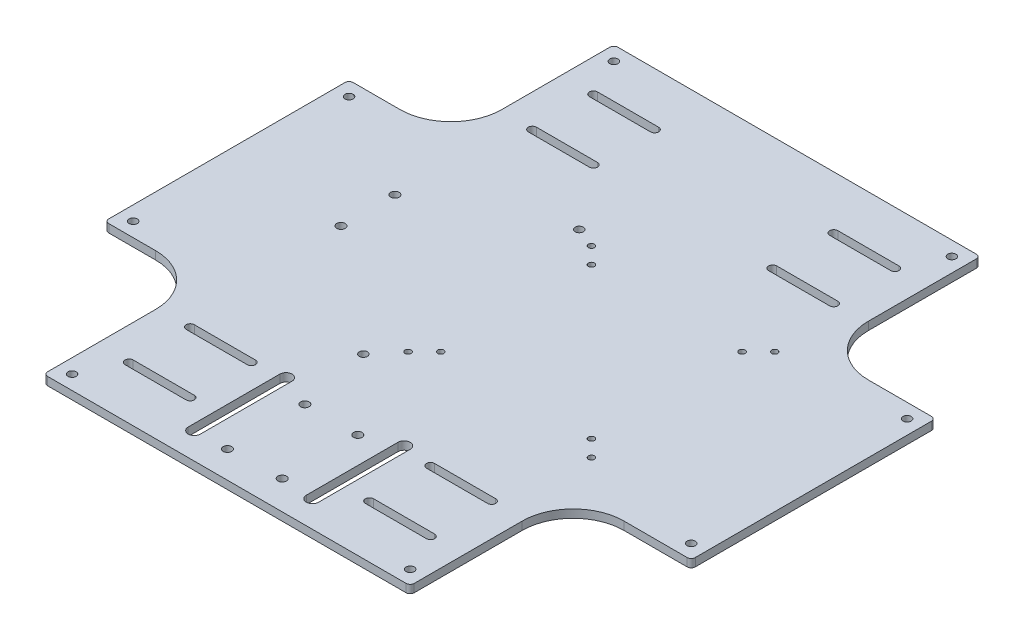
from build123d import *

# Parameters (mm, degrees)
SKETCH_1_R               = 2
EXTRUDE_1_DEPTH          = 4
CUT_EXTRUDE_1_DEPTH      = 202.596130915
CUT_EXTRUDE_1_DEPTH_BACK = 202.596130915
CUT_EXTRUDE_2_DEPTH      = 202.596130915
CUT_EXTRUDE_2_DEPTH_BACK = 202.596130915
SKETCH_3_R               = 2.1
SKETCH_4_W               = 8
SKETCH_4_H               = 120
EXTRUDE_2_DEPTH          = 4
CUT_EXTRUDE_4_DEPTH      = 208.231754324
CUT_EXTRUDE_4_DEPTH_BACK = 208.231754324
SKETCH_6_R               = 2
CUT_EXTRUDE_5_DEPTH      = 208.231754324
CUT_EXTRUDE_6_DEPTH      = 221.692093198
CUT_EXTRUDE_6_DEPTH_BACK = 221.692093198
SKETCH_9_R               = 1.5
FILLET_1_R               = 2
FILLET_2_R               = 25
SKETCH_11_R              = 2.1
CUT_EXTRUDE_7_DEPTH      = 10


with BuildPart() as part:
    # 草图1 → 凸台-拉伸1 (new body)
    with BuildSketch(Plane(origin=(0, 0, 0), x_dir=(1, 0, 0), z_dir=(0, 1, 0))):
        Polygon((-90, -145), (90, -145), (90, -65), (140, -65), (140, 55), (90, 55), (90, 135), (-90, 135), (-90, 55), (-140, 55), (-140, -65), (-90, -65), align=None)
        with Locations(Location((-83, -138, 0), (0, 0, 270))):
            Circle(SKETCH_1_R, mode=Mode.SUBTRACT)
        with Locations(Location((-83, 128, 0), (0, 0, 270))):
            Circle(SKETCH_1_R, mode=Mode.SUBTRACT)
        with Locations(Location((83, -138, 0), (0, 0, 90))):
            Circle(SKETCH_1_R, mode=Mode.SUBTRACT)
        with Locations(Location((83, 128, 0), (0, 0, 90))):
            Circle(SKETCH_1_R, mode=Mode.SUBTRACT)
        with Locations(Location((-133, 48, 0), (0, 0, 270))):
            Circle(SKETCH_1_R, mode=Mode.SUBTRACT)
        with Locations(Location((-133, -58, 0), (0, 0, 270))):
            Circle(SKETCH_1_R, mode=Mode.SUBTRACT)
        with Locations(Location((-20, 48, 0), (0, 0, 270))):
            Circle(SKETCH_1_R, mode=Mode.SUBTRACT)
        with Locations(Location((-20, -58, 0), (0, 0, 270))):
            Circle(SKETCH_1_R, mode=Mode.SUBTRACT)
    extrude(amount=EXTRUDE_1_DEPTH)

    # 草图2 → 切除-拉伸1 (cut, two sides: drawn at the far end of the back side and taken through both)
    with BuildSketch(Plane(origin=(0, 4, 0), x_dir=(1, 0, 0), z_dir=(0, 1, 0)).offset(-CUT_EXTRUDE_1_DEPTH_BACK)):
        with BuildLine():
            Line((-74, -117), (-44, -117))
            ThreePointArc((-44, -117), (-42, -119), (-44, -121))
            Line((-44, -121), (-74, -121))
            ThreePointArc((-74, -121), (-76, -119), (-74, -117))
        make_face()
        with BuildLine():
            Line((-74, -87), (-44, -87))
            ThreePointArc((-44, -87), (-42, -89), (-44, -91))
            Line((-44, -91), (-74, -91))
            ThreePointArc((-74, -91), (-76, -89), (-74, -87))
        make_face()
        with BuildLine():
            Line((74, -87), (44, -87))
            ThreePointArc((44, -87), (42, -89), (44, -91))
            Line((44, -91), (74, -91))
            ThreePointArc((74, -91), (76, -89), (74, -87))
        make_face()
        with BuildLine():
            Line((74, -117), (44, -117))
            ThreePointArc((44, -117), (42, -119), (44, -121))
            Line((44, -121), (74, -121))
            ThreePointArc((74, -121), (76, -119), (74, -117))
        make_face()
        with BuildLine():
            Line((74, 107), (44, 107))
            ThreePointArc((44, 107), (42, 109), (44, 111))
            Line((44, 111), (74, 111))
            ThreePointArc((74, 111), (76, 109), (74, 107))
        make_face()
        with BuildLine():
            Line((74, 77), (44, 77))
            ThreePointArc((44, 77), (42, 79), (44, 81))
            Line((44, 81), (74, 81))
            ThreePointArc((74, 81), (76, 79), (74, 77))
        make_face()
        with BuildLine():
            Line((-74, 77), (-44, 77))
            ThreePointArc((-44, 77), (-42, 79), (-44, 81))
            Line((-44, 81), (-74, 81))
            ThreePointArc((-74, 81), (-76, 79), (-74, 77))
        make_face()
        with BuildLine():
            Line((-74, 107), (-44, 107))
            ThreePointArc((-44, 107), (-42, 109), (-44, 111))
            Line((-44, 111), (-74, 111))
            ThreePointArc((-74, 111), (-76, 109), (-74, 107))
        make_face()
    extrude(amount=CUT_EXTRUDE_1_DEPTH + CUT_EXTRUDE_1_DEPTH_BACK, mode=Mode.SUBTRACT)

    # 草图3 → 切除-拉伸2 (cut, two sides: drawn at the far end of the back side and taken through both)
    with BuildSketch(Plane(origin=(0, 4, 0), x_dir=(1, 0, 0), z_dir=(0, 1, 0)).offset(-CUT_EXTRUDE_2_DEPTH_BACK)):
        with Locations(Location((-80, 17.529194913, 0), (0, 0, 270))):
            Circle(SKETCH_3_R)
        with Locations(Location((-80, -9, 0), (0, 0, 270))):
            Circle(SKETCH_3_R)
    extrude(amount=CUT_EXTRUDE_2_DEPTH + CUT_EXTRUDE_2_DEPTH_BACK, mode=Mode.SUBTRACT)

    # 草图4 → 凸台-拉伸2 (add)
    with BuildSketch(Plane(origin=(0, 4, 0), x_dir=(1, 0, 0), z_dir=(0, 1, 0))):
        with Locations((144, -5)):
            Rectangle(SKETCH_4_W, SKETCH_4_H)
    extrude(amount=-EXTRUDE_2_DEPTH)

    # 草图6 → 切除-拉伸4 (cut, two sides: drawn at the far end of the back side and taken through both)
    with BuildSketch(Plane.XZ.offset(-CUT_EXTRUDE_4_DEPTH_BACK)):
        with Locations(Location((141, 58, 0), (0, 0, 270))):
            Circle(SKETCH_6_R)
        with Locations(Location((141, -48, 0), (0, 0, 270))):
            Circle(SKETCH_6_R)
    extrude(amount=CUT_EXTRUDE_4_DEPTH + CUT_EXTRUDE_4_DEPTH_BACK, mode=Mode.SUBTRACT)

    # 草图7 → 切除-拉伸5 (cut, through all)
    with BuildSketch(Plane(origin=(0, 4, 0), x_dir=(1, 0, 0), z_dir=(0, 1, 0))):
        with BuildLine():
            Line((-26, -87), (-26, -132))
            ThreePointArc((-26, -132), (-29, -135), (-32, -132))
            Line((-32, -132), (-32, -87))
            ThreePointArc((-32, -87), (-29, -84), (-26, -87))
        make_face()
        with BuildLine():
            Line((32, -87), (32, -132))
            ThreePointArc((32, -132), (29, -135), (26, -132))
            Line((26, -132), (26, -87))
            ThreePointArc((26, -87), (29, -84), (32, -87))
        make_face()
    extrude(amount=-CUT_EXTRUDE_5_DEPTH, mode=Mode.SUBTRACT)

    # 草图9 → 切除-拉伸6 (cut, two sides: drawn at the far end of the back side and taken through both)
    with BuildSketch(Plane(origin=(0, 76, 0), x_dir=(1, 0, 0), z_dir=(0, 1, 0)).offset(-CUT_EXTRUDE_6_DEPTH_BACK)):
        with Locations(Location((72, -38, 0), (0, 0, 180))):
            Circle(SKETCH_9_R)
        with Locations(Location((-2, -38, 0), (0, 0, 180))):
            Circle(SKETCH_9_R)
        with Locations(Location((72, 36, 0), (0, 0, 180))):
            Circle(SKETCH_9_R)
        with Locations(Location((-2, 36, 0), (0, 0, 180))):
            Circle(SKETCH_9_R)
        with Locations(Location((80, -46, 0), (0, 0, 180))):
            Circle(SKETCH_9_R)
        with Locations(Location((-10, -46, 0), (0, 0, 180))):
            Circle(SKETCH_9_R)
        with Locations(Location((-10, 44, 0), (0, 0, 180))):
            Circle(SKETCH_9_R)
        with Locations(Location((80, 44, 0), (0, 0, 180))):
            Circle(SKETCH_9_R)
    extrude(amount=CUT_EXTRUDE_6_DEPTH + CUT_EXTRUDE_6_DEPTH_BACK, mode=Mode.SUBTRACT)

    # 圆角1
    fillet_1_edges = [part.edges().sort_by_distance(p)[0] for p in [
        (148, 2, -55),
        (148, 2, 65),
        (90, 2, 145),
        (-90, 2, 145),
        (-140, 2, 65),
        (-140, 2, -55),
        (-90, 2, -135),
        (90, 2, -135),
    ]]
    fillet(fillet_1_edges, radius=FILLET_1_R)

    # 圆角2
    fillet_2_edges = [part.edges().sort_by_distance(p)[0] for p in [
        (90, 2, -55),
        (90, 2, 65),
        (-90, 2, 65),
        (-90, 2, -55),
    ]]
    fillet(fillet_2_edges, radius=FILLET_2_R)

    # 草图11 → 切除-拉伸7 (cut)
    with BuildSketch(Plane(origin=(0, 4, 0), x_dir=(1, 0, 0), z_dir=(0, 1, 0))):
        with Locations(Location((-13, -131.714712401, 0), (0, 0, 270))):
            Circle(SKETCH_11_R)
        with Locations(Location((13, -130.851588753, 0), (0, 0, 270))):
            Circle(SKETCH_11_R)
        with Locations(Location((13, -93.714712401, 0), (0, 0, 270))):
            Circle(SKETCH_11_R)
        with Locations(Location((-13, -93.714712401, 0), (0, 0, 270))):
            Circle(SKETCH_11_R)
    extrude(amount=-CUT_EXTRUDE_7_DEPTH, mode=Mode.SUBTRACT)


solid = part.part
